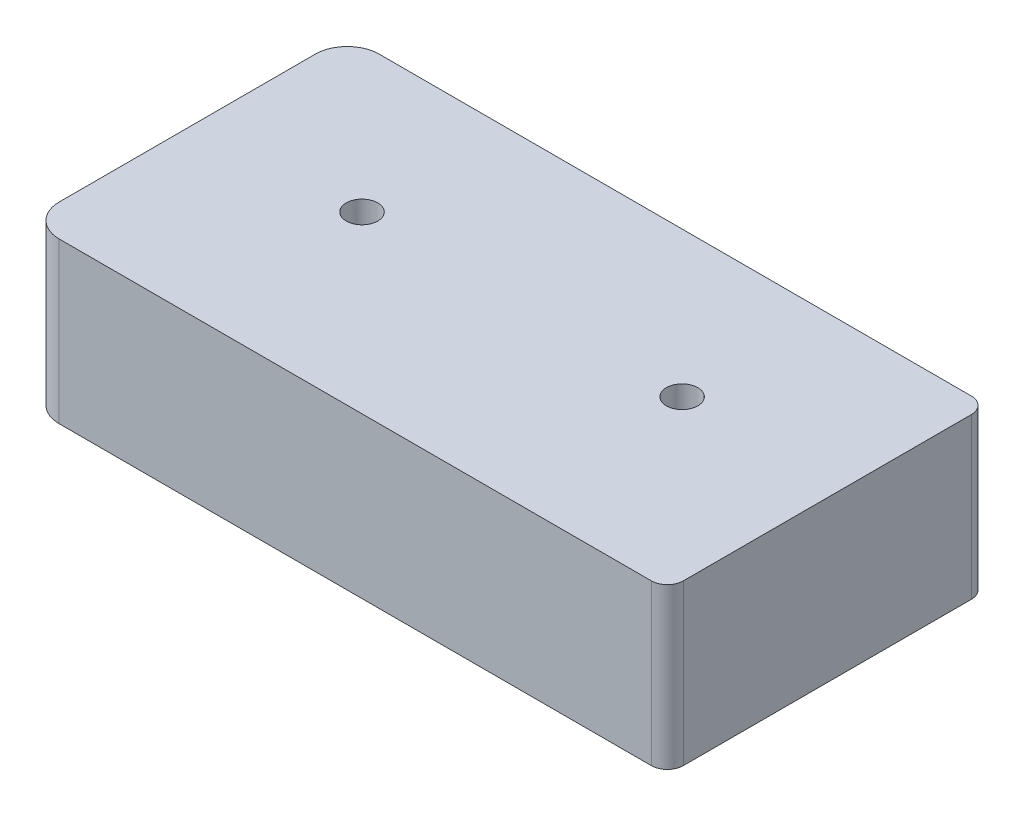
from build123d import *

# Parameters (mm, degrees)
SKETCH1_W           = 101.6
SKETCH1_H           = 50.8
BOSS_EXTRUDE1_DEPTH = 25.4
FILLET1_R           = 5.08
FILLET2_R           = 2.54
SKETCH2_R           = 2.5
CUT_EXTRUDE1_DEPTH  = 25.4


with BuildPart() as part:
    # Sketch1 → Boss-Extrude1 (new body)
    with BuildSketch(Plane(origin=(0, 0, 0), x_dir=(1, 0, 0), z_dir=(0, 1, 0))):
        with Locations((0, -2.342718447)):
            Rectangle(SKETCH1_W, SKETCH1_H)
    extrude(amount=BOSS_EXTRUDE1_DEPTH)

    # Fillet1
    fillet1_edges = [part.edges().sort_by_distance(p)[0] for p in [
        (-50.8, 12.7, -23.057281553),
        (-50.8, 12.7, 27.742718447),
    ]]
    fillet(fillet1_edges, radius=FILLET1_R)

    # Fillet2
    fillet2_edges = [part.edges().sort_by_distance(p)[0] for p in [
        (50.8, 12.7, -23.057281553),
        (50.8, 12.7, 27.742718447),
    ]]
    fillet(fillet2_edges, radius=FILLET2_R)

    # Sketch2 → Cut-Extrude1 (cut)
    with BuildSketch(Plane(origin=(0, 25.4, 0), x_dir=(1, 0, 0), z_dir=(0, 1, 0))):
        with Locations(Location((-25.4, 0, 0), (0, 0, 270))):
            Circle(SKETCH2_R)
        with Locations(Location((25.4, 0, 0), (0, 0, 270))):
            Circle(SKETCH2_R)
    extrude(amount=-CUT_EXTRUDE1_DEPTH, mode=Mode.SUBTRACT)


solid = part.part
